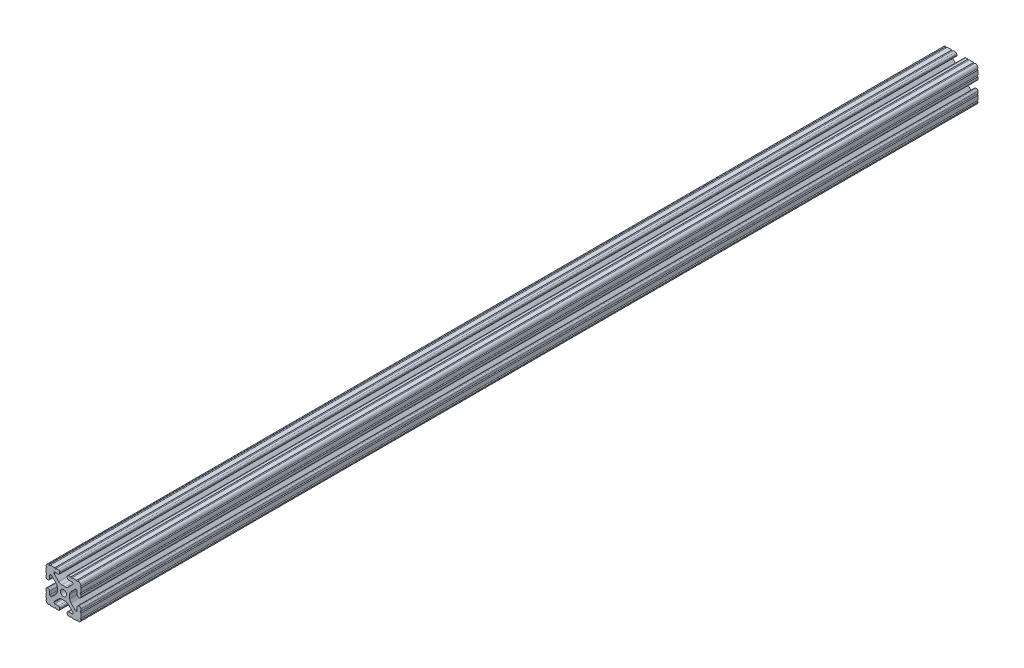
from build123d import *

# Parameters (mm, degrees)
SKETCH1_R      = 3.3274
EXTRUDE1_DEPTH = 977.9


with BuildPart() as part:
    # Sketch1 → Extrude1 (new body)
    with BuildSketch(Plane.XY):
        with BuildLine():
            Line((-10.022898969, 12.91475973), (-5.252158105, 8.144007132))
            ThreePointArc((-5.252158105, 8.144007132), (-3.715177372, 7.117027388), (-1.902183975, 6.7564))
            Line((-1.902183975, 6.7564), (1.902183975, 6.7564))
            ThreePointArc((1.902183975, 6.7564), (3.715177372, 7.117027388), (5.252158105, 8.144007132))
            Line((5.252158105, 8.144007132), (10.022898969, 12.91475973))
            ThreePointArc((10.022898969, 12.91475973), (10.218362387, 13.207291992), (10.287, 13.552357131))
            Line((10.287, 13.552357131), (10.287, 14.0843))
            ThreePointArc((10.287, 14.0843), (10.022898185, 14.721898185), (9.3853, 14.986))
            Line((9.3853, 14.986), (5.617617549, 14.986))
            ThreePointArc((5.617617549, 14.986), (4.519044045, 15.441044045), (4.064, 16.539617549))
            Line((4.064, 16.539617549), (4.064, 17.496382451))
            ThreePointArc((4.064, 17.496382451), (4.519044045, 18.594955955), (5.617617549, 19.05))
            Line((5.617617549, 19.05), (7.974178704, 19.05))
            ThreePointArc((7.974178704, 19.05), (8.736178704, 18.288), (9.498178704, 19.05))
            Line((9.498178704, 19.05), (14.327719207, 19.05))
            ThreePointArc((14.327719207, 19.05), (15.087603123, 18.231251131), (15.847487039, 19.05))
            ThreePointArc((15.847487039, 19.05), (18.120176289, 18.120192083), (19.05, 15.847509295))
            ThreePointArc((19.05, 15.847509295), (18.231250992, 15.08762539), (19.05, 14.327741484))
            Line((19.05, 14.327741484), (19.05, 9.496091471))
            ThreePointArc((19.05, 9.496091471), (18.231250992, 8.736207565), (19.05, 7.97632366))
            Line((19.05, 7.97632366), (19.05, 5.617617549))
            ThreePointArc((19.05, 5.617617549), (18.594955955, 4.519044045), (17.496382451, 4.064))
            Line((17.496382451, 4.064), (16.539617549, 4.064))
            ThreePointArc((16.539617549, 4.064), (15.441044045, 4.519044045), (14.986, 5.617617549))
            Line((14.986, 5.617617549), (14.986, 9.385342516))
            ThreePointArc((14.986, 9.385342516), (14.721898185, 10.022940701), (14.0843, 10.287042516))
            Line((14.0843, 10.287042516), (13.516042086, 10.287042516))
            ThreePointArc((13.516042086, 10.287042516), (13.170975923, 10.218404478), (12.878443117, 10.022939917))
            Line((12.878443117, 10.022939917), (8.14758008, 5.292065243))
            ThreePointArc((8.14758008, 5.292065243), (7.117955879, 3.751120653), (6.7564, 1.933453584))
            Line((6.7564, 1.933453584), (6.7564, -1.933453584))
            ThreePointArc((6.7564, -1.933453584), (7.117955879, -3.751120653), (8.14758008, -5.292065243))
            Line((8.14758008, -5.292065243), (12.878443117, -10.022939917))
            ThreePointArc((12.878443117, -10.022939917), (13.170975923, -10.218404478), (13.516042086, -10.287042516))
            Line((13.516042086, -10.287042516), (14.0843, -10.287042516))
            ThreePointArc((14.0843, -10.287042516), (14.721898185, -10.022940701), (14.986, -9.385342516))
            Line((14.986, -9.385342516), (14.986, -5.617617549))
            ThreePointArc((14.986, -5.617617549), (15.441044045, -4.519044045), (16.539617549, -4.064))
            Line((16.539617549, -4.064), (17.496382451, -4.064))
            ThreePointArc((17.496382451, -4.064), (18.594955955, -4.519044045), (19.05, -5.617617549))
            Line((19.05, -5.617617549), (19.05, -7.976318491))
            ThreePointArc((19.05, -7.976318491), (18.231250992, -8.736202396), (19.05, -9.496086302))
            Line((19.05, -9.496086302), (19.05, -14.32774291))
            ThreePointArc((19.05, -14.32774291), (18.231250992, -15.087626816), (19.05, -15.847510721))
            ThreePointArc((19.05, -15.847510721), (18.120175716, -18.120192644), (15.847486868, -19.05))
            ThreePointArc((15.847486868, -19.05), (15.087602952, -18.231251131), (14.327719036, -19.05))
            Line((14.327719036, -19.05), (9.496062448, -19.05))
            ThreePointArc((9.496062448, -19.05), (8.736178532, -18.231251131), (7.976294616, -19.05))
            Line((7.976294616, -19.05), (5.617617549, -19.05))
            ThreePointArc((5.617617549, -19.05), (4.519044045, -18.594955955), (4.064, -17.496382451))
            Line((4.064, -17.496382451), (4.064, -16.539617549))
            ThreePointArc((4.064, -16.539617549), (4.519044045, -15.441044045), (5.617617549, -14.986))
            Line((5.617617549, -14.986), (9.3853, -14.986))
            ThreePointArc((9.3853, -14.986), (10.022898185, -14.721898185), (10.287, -14.0843))
            Line((10.287, -14.0843), (10.287, -13.552357131))
            ThreePointArc((10.287, -13.552357131), (10.218362387, -13.207291992), (10.022898969, -12.91475973))
            Line((10.022898969, -12.91475973), (5.252158105, -8.144007132))
            ThreePointArc((5.252158105, -8.144007132), (3.715177372, -7.117027388), (1.902183975, -6.7564))
            Line((1.902183975, -6.7564), (-1.902183975, -6.7564))
            ThreePointArc((-1.902183975, -6.7564), (-3.715177372, -7.117027388), (-5.252158105, -8.144007132))
            Line((-5.252158105, -8.144007132), (-10.022898969, -12.91475973))
            ThreePointArc((-10.022898969, -12.91475973), (-10.218362387, -13.207291992), (-10.287, -13.552357131))
            Line((-10.287, -13.552357131), (-10.287, -14.0843))
            ThreePointArc((-10.287, -14.0843), (-10.022898185, -14.721898185), (-9.3853, -14.986))
            Line((-9.3853, -14.986), (-5.617617549, -14.986))
            ThreePointArc((-5.617617549, -14.986), (-4.519044045, -15.441044045), (-4.064, -16.539617549))
            Line((-4.064, -16.539617549), (-4.064, -17.496382451))
            ThreePointArc((-4.064, -17.496382451), (-4.519044045, -18.594955955), (-5.617617549, -19.05))
            Line((-5.617617549, -19.05), (-7.976294616, -19.05))
            ThreePointArc((-7.976294616, -19.05), (-8.736178532, -18.231251131), (-9.496062448, -19.05))
            Line((-9.496062448, -19.05), (-14.327719036, -19.05))
            ThreePointArc((-14.327719036, -19.05), (-15.087602952, -18.231251131), (-15.847486868, -19.05))
            ThreePointArc((-15.847486868, -19.05), (-18.120175716, -18.120192644), (-19.05, -15.847510721))
            ThreePointArc((-19.05, -15.847510721), (-18.231250992, -15.087626816), (-19.05, -14.32774291))
            Line((-19.05, -14.32774291), (-19.05, -9.496086302))
            ThreePointArc((-19.05, -9.496086302), (-18.231250992, -8.736202396), (-19.05, -7.976318491))
            Line((-19.05, -7.976318491), (-19.05, -5.617617549))
            ThreePointArc((-19.05, -5.617617549), (-18.594955955, -4.519044045), (-17.496382451, -4.064))
            Line((-17.496382451, -4.064), (-16.539617549, -4.064))
            ThreePointArc((-16.539617549, -4.064), (-15.441044045, -4.519044045), (-14.986, -5.617617549))
            Line((-14.986, -5.617617549), (-14.986, -9.385342516))
            ThreePointArc((-14.986, -9.385342516), (-14.721898185, -10.022940701), (-14.0843, -10.287042516))
            Line((-14.0843, -10.287042516), (-13.516042086, -10.287042516))
            ThreePointArc((-13.516042086, -10.287042516), (-13.170975923, -10.218404478), (-12.878443117, -10.022939917))
            Line((-12.878443117, -10.022939917), (-8.14758008, -5.292065243))
            ThreePointArc((-8.14758008, -5.292065243), (-7.117955879, -3.751120653), (-6.7564, -1.933453584))
            Line((-6.7564, -1.933453584), (-6.7564, 1.933453584))
            ThreePointArc((-6.7564, 1.933453584), (-7.117955879, 3.751120653), (-8.14758008, 5.292065243))
            Line((-8.14758008, 5.292065243), (-12.878443117, 10.022939917))
            ThreePointArc((-12.878443117, 10.022939917), (-13.170975923, 10.218404478), (-13.516042086, 10.287042516))
            Line((-13.516042086, 10.287042516), (-14.0843, 10.287042516))
            ThreePointArc((-14.0843, 10.287042516), (-14.721898185, 10.022940701), (-14.986, 9.385342516))
            Line((-14.986, 9.385342516), (-14.986, 5.617617549))
            ThreePointArc((-14.986, 5.617617549), (-15.441044045, 4.519044045), (-16.539617549, 4.064))
            Line((-16.539617549, 4.064), (-17.496382451, 4.064))
            ThreePointArc((-17.496382451, 4.064), (-18.594955955, 4.519044045), (-19.05, 5.617617549))
            Line((-19.05, 5.617617549), (-19.05, 7.97632366))
            ThreePointArc((-19.05, 7.97632366), (-18.231250992, 8.736207565), (-19.05, 9.496091471))
            Line((-19.05, 9.496091471), (-19.05, 14.327741484))
            ThreePointArc((-19.05, 14.327741484), (-18.231250992, 15.08762539), (-19.05, 15.847509295))
            ThreePointArc((-19.05, 15.847509295), (-18.120176289, 18.120192083), (-15.847487039, 19.05))
            ThreePointArc((-15.847487039, 19.05), (-15.087603123, 18.231251131), (-14.327719207, 19.05))
            Line((-14.327719207, 19.05), (-9.498178704, 19.05))
            ThreePointArc((-9.498178704, 19.05), (-8.736178704, 18.288), (-7.974178704, 19.05))
            Line((-7.974178704, 19.05), (-5.617617549, 19.05))
            ThreePointArc((-5.617617549, 19.05), (-4.519044045, 18.594955955), (-4.064, 17.496382451))
            Line((-4.064, 17.496382451), (-4.064, 16.539617549))
            ThreePointArc((-4.064, 16.539617549), (-4.519044045, 15.441044045), (-5.617617549, 14.986))
            Line((-5.617617549, 14.986), (-9.3853, 14.986))
            ThreePointArc((-9.3853, 14.986), (-10.022898185, 14.721898185), (-10.287, 14.0843))
            Line((-10.287, 14.0843), (-10.287, 13.552357131))
            ThreePointArc((-10.287, 13.552357131), (-10.218362387, 13.207291992), (-10.022898969, 12.91475973))
        make_face()
        Circle(SKETCH1_R, mode=Mode.SUBTRACT)
    extrude(amount=-EXTRUDE1_DEPTH)


solid = part.part
